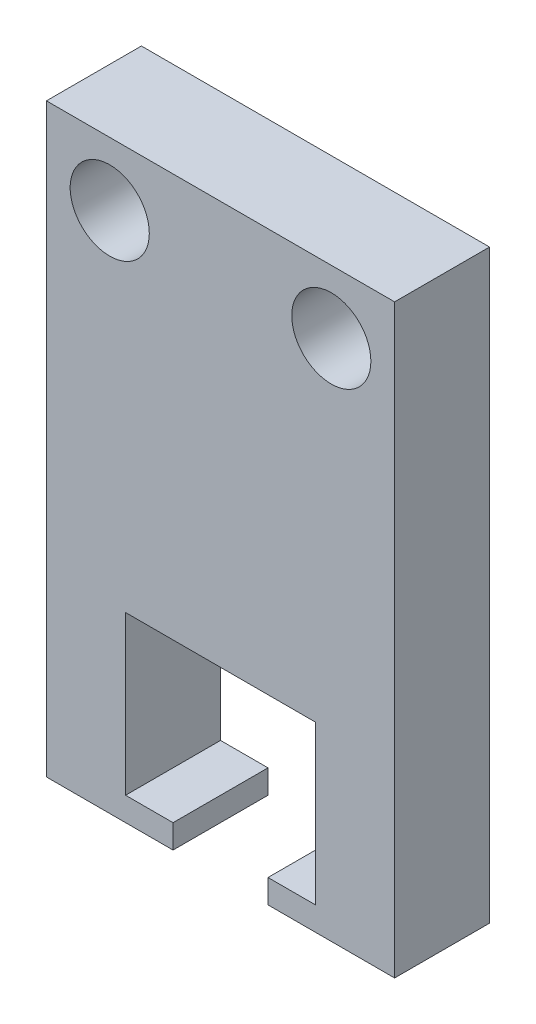
from build123d import *

# Parameters (mm, degrees)
SKETCH1_W           = 22
SKETCH1_H           = 37
SKETCH1_R           = 2.5
SKETCH1_W_2         = 12
SKETCH1_H_2         = 10
BOSS_EXTRUDE2_DEPTH = 6
CUT_EXTRUDE2_DEPTH  = 6


with BuildPart() as part:
    # Sketch1 → Boss-Extrude2 (new body)
    with BuildSketch(Plane.XY):
        Rectangle(SKETCH1_W, SKETCH1_H)
        with Locations((-7, 14.5)):
            Circle(SKETCH1_R, mode=Mode.SUBTRACT)
        with Locations((7, 14.5)):
            Circle(SKETCH1_R, mode=Mode.SUBTRACT)
        with Locations((0, -12)):
            Rectangle(SKETCH1_W_2, SKETCH1_H_2, mode=Mode.SUBTRACT)
    extrude(amount=BOSS_EXTRUDE2_DEPTH)

    # Sketch3 → Cut-Extrude2 (cut)
    with BuildSketch(Plane(origin=(0, 0, 0), x_dir=(-1, 0, 0), z_dir=(0, 0, -1))):
        Polygon((0, -17), (-3, -17), (-3, -18.5), (0, -18.5), (3, -18.5), (3, -17), align=None)
    extrude(amount=-CUT_EXTRUDE2_DEPTH, mode=Mode.SUBTRACT)


solid = part.part
